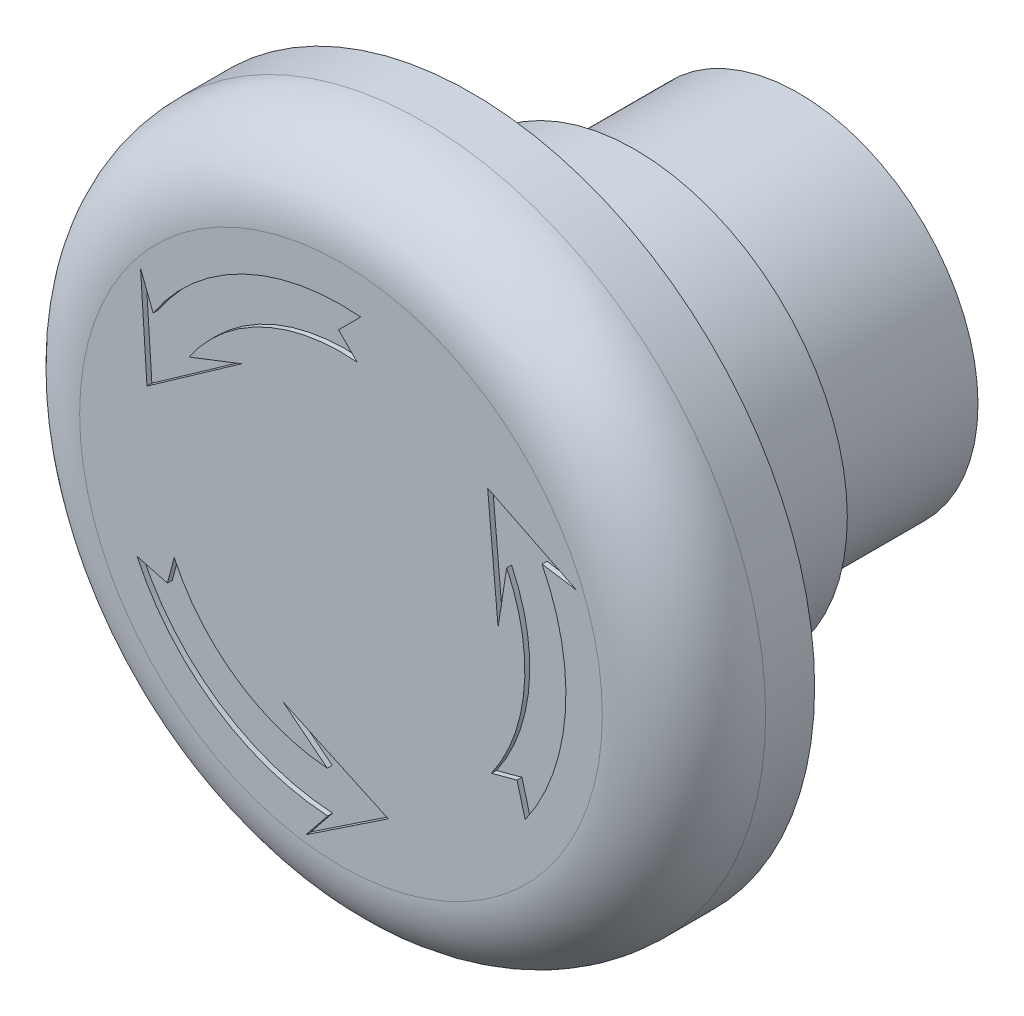
from build123d import *

# Parameters (mm, degrees)
SKETCH_1_R               = 11
EXTRUDE_1_DEPTH          = 10
SKETCH_2_R               = 13
EXTRUDE_2_DEPTH          = 10
SKETCH_6_R               = 21
EXTRUDE_5_DEPTH          = 8
FILLET_4_R               = 5
CUT_EXTRUDE_3_DEPTH      = 0.3
PATTERN_CIRCULAR_1_COUNT = 3


with BuildPart() as part:
    # 草图1 → 凸台-拉伸1 (new body)
    with BuildSketch(Plane.XY):
        Circle(SKETCH_1_R)
    extrude(amount=EXTRUDE_1_DEPTH)

    # 草图2 → 凸台-拉伸2 (add)
    with BuildSketch(Plane.XY.offset(10)):
        Circle(SKETCH_2_R)
    extrude(amount=EXTRUDE_2_DEPTH)

    # 草图6 → 凸台-拉伸5 (add)
    with BuildSketch(Plane.XY.offset(20)):
        Circle(SKETCH_6_R)
    extrude(amount=EXTRUDE_5_DEPTH)

    # 圆角4
    fillet_4_edges = [part.edges().sort_by_distance(p)[0] for p in [
        (-21, 0, 28),
    ]]
    fillet(fillet_4_edges, radius=FILLET_4_R)

    # 草图7 → 切除-拉伸3 (cut)
    with BuildSketch(Plane.XY.offset(28)):
        with BuildLine():
            Line((-9.304992191, 6.340429284), (-6.090228266, 7.590754313))
            Line((-6.090228266, 7.590754313), (-11.877072904, 3.512738797))
            Line((-11.877072904, 3.512738797), (-12.271255314, 9.560904356))
            Line((-12.271255314, 9.560904356), (-11.499666165, 7.577038638))
            ThreePointArc((-11.499666165, 7.577038638), (-5.993368065, 12.398926391), (1.205826183, 13.718593938))
            Line((1.205826183, 13.718593938), (-0.151715423, 12.361052332))
            Line((-0.151715423, 12.361052332), (0.993407881, 11.215929028))
            ThreePointArc((0.993407881, 11.215929028), (-4.818011299, 10.176968621), (-9.304992191, 6.340429284))
        make_face()
    cut_extrude_3 = extrude(amount=-CUT_EXTRUDE_3_DEPTH, mode=Mode.SUBTRACT)

    # 阵列(圆周)1: 切除-拉伸3 ×3 about axis
    pattern_circular_1_axis = Axis((0, 0, 20), (0, 0, -1))
    for i in range(1, PATTERN_CIRCULAR_1_COUNT):
        add(cut_extrude_3.rotate(pattern_circular_1_axis, i * 360 / PATTERN_CIRCULAR_1_COUNT), mode=Mode.SUBTRACT)


solid = part.part
